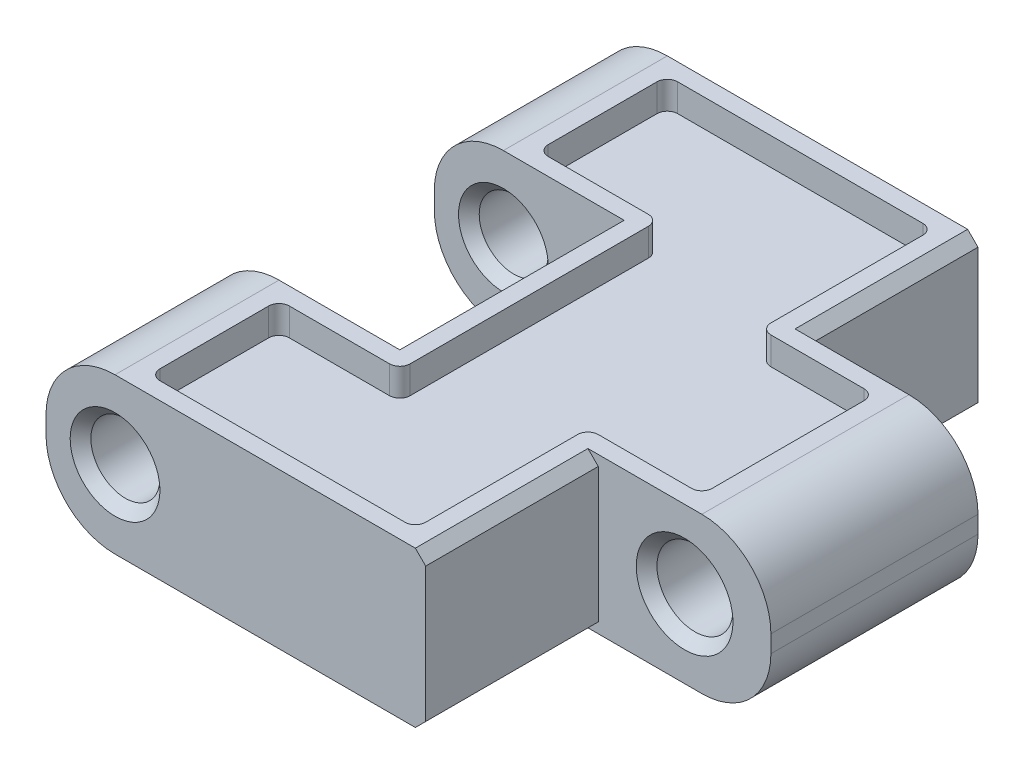
from build123d import *

# Parameters (mm, degrees)
GRUNDK_RPER_DEPTH         = 4.5
ACHSBOHHRUNGEN_DEPTH      = 19.445866746
ACHSBOHHRUNGEN_DEPTH_BACK = 19.445866746
SKIZZE2_R                 = 1
SKIZZE2_R_2               = 1.1
SKIZZE3_W                 = 2
SKIZZE3_H                 = 6.5
AUSSCHNITT_ZAHN_DEPTH     = 3
VERRUNDUNG2_R             = 2
FASE1_SIZE                = 0.3
FASE2_SIZE                = 0.3
MOOSGUMMIVERTIEFUNG_DEPTH = 0.8
VERRUNDUNG8_R             = 0.3


with BuildPart() as part:
    # Skizze1 → Grundkörper (new body)
    with BuildSketch(Plane(origin=(0, 0, 0), x_dir=(1, 0, 0), z_dir=(0, 1, 0))):
        Polygon((5.5, 3.25), (5.5, -3.25), (0, -3.25), (0, -8), (11, -8), (11, -3), (16, -3), (16, 3), (11, 3), (11, 8), (0, 8), (0, 3.25), align=None)
    extrude(amount=GRUNDK_RPER_DEPTH)

    # Skizze2 → Achsbohhrungen (cut, two sides: drawn at the far end of the back side and taken through both)
    with BuildSketch(Plane.XY.offset(-ACHSBOHHRUNGEN_DEPTH_BACK)):
        with Locations((2, 2.25)):
            Circle(SKIZZE2_R)
        with Locations((13.5, 2.25)):
            Circle(SKIZZE2_R_2)
    extrude(amount=ACHSBOHHRUNGEN_DEPTH + ACHSBOHHRUNGEN_DEPTH_BACK, mode=Mode.SUBTRACT)

    # Skizze3 → Ausschnitt Zahn (cut)
    with BuildSketch(Plane.XZ):
        with Locations((6.5, 0)):
            Rectangle(SKIZZE3_W, SKIZZE3_H)
    extrude(amount=-AUSSCHNITT_ZAHN_DEPTH, mode=Mode.SUBTRACT)

    # Verrundung2
    verrundung2_edges = [part.edges().sort_by_distance(p)[0] for p in [
        (0, 0, -5.625),
        (16, 0, 0),
        (0, 0, 5.625),
        (16, 4.5, 0),
        (0, 4.5, -5.625),
        (0, 4.5, 5.625),
    ]]
    fillet(verrundung2_edges, radius=VERRUNDUNG2_R)

    # Fase1
    fase1_edges = [part.edges().sort_by_distance(p)[0] for p in [
        (11, 0, -5.5),
        (11, 4.5, 5.5),
        (11, 0, 5.5),
        (11, 4.5, -5.5),
    ]]
    chamfer(fase1_edges, length=FASE1_SIZE)

    # Fase2
    fase2_edges = [part.edges().sort_by_distance(p)[0] for p in [
        (1, 2.25, 3.25),
        (1, 2.25, -8),
        (1, 2.25, -3.25),
        (1, 2.25, 8),
        (12.4, 2.25, -3),
        (12.4, 2.25, 3),
    ]]
    chamfer(fase2_edges, length=FASE2_SIZE)

    # Skizze6 → MoosgummiVertiefung (cut)
    with BuildSketch(Plane(origin=(0, 4.5, 0), x_dir=(1, 0, 0), z_dir=(0, 1, 0))):
        Polygon((13.5, -2.5), (13.5, 2.5), (10.2, 2.5), (10.2, 7.5), (2.5, 7.5), (2.5, 3.75), (6, 3.75), (6, -3.75), (2.5, -3.75), (2.5, -7.5), (10.2, -7.5), (10.2, -2.5), align=None)
    extrude(amount=-MOOSGUMMIVERTIEFUNG_DEPTH, mode=Mode.SUBTRACT)

    # Verrundung8
    verrundung8_edges = [part.edges().sort_by_distance(p)[0] for p in [
        (13.5, 4.1, 2.5),
        (10.2, 4.1, 2.5),
        (10.2, 4.1, 7.5),
        (2.5, 4.1, 7.5),
        (2.5, 4.1, 3.75),
        (6, 4.1, 3.75),
        (6, 4.1, -3.75),
        (2.5, 4.1, -3.75),
        (2.5, 4.1, -7.5),
        (10.2, 4.1, -7.5),
        (10.2, 4.1, -2.5),
        (13.5, 4.1, -2.5),
    ]]
    fillet(verrundung8_edges, radius=VERRUNDUNG8_R)


solid = part.part
